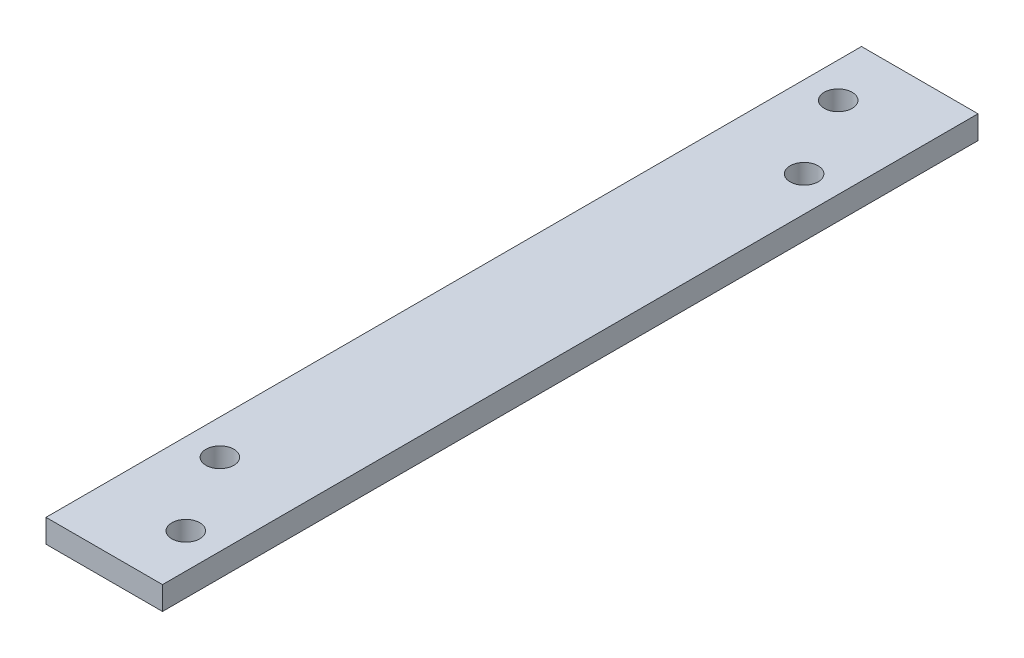
from build123d import *

# Parameters (mm, degrees)
SKETCH1_W           = 12.7
SKETCH1_H           = 88.9
SKETCH1_R           = 1.524
BOSS_EXTRUDE1_DEPTH = 2.54


with BuildPart() as part:
    # Sketch1 → Boss-Extrude1 (new body)
    with BuildSketch(Plane(origin=(0, 0, 0), x_dir=(1, 0, 0), z_dir=(0, 1, 0))):
        with Locations((6.35, 44.45)):
            Rectangle(SKETCH1_W, SKETCH1_H)
        with Locations(Location((3.81, 82.55, 0), (0, 0, 270))):
            Circle(SKETCH1_R, mode=Mode.SUBTRACT)
        with Locations(Location((8.89, 73.751181898, 0), (0, 0, 270))):
            Circle(SKETCH1_R, mode=Mode.SUBTRACT)
        with Locations(Location((3.81, 15.148818102, 0), (0, 0, 270))):
            Circle(SKETCH1_R, mode=Mode.SUBTRACT)
        with Locations(Location((8.89, 6.35, 0), (0, 0, 270))):
            Circle(SKETCH1_R, mode=Mode.SUBTRACT)
    extrude(amount=BOSS_EXTRUDE1_DEPTH)


solid = part.part
